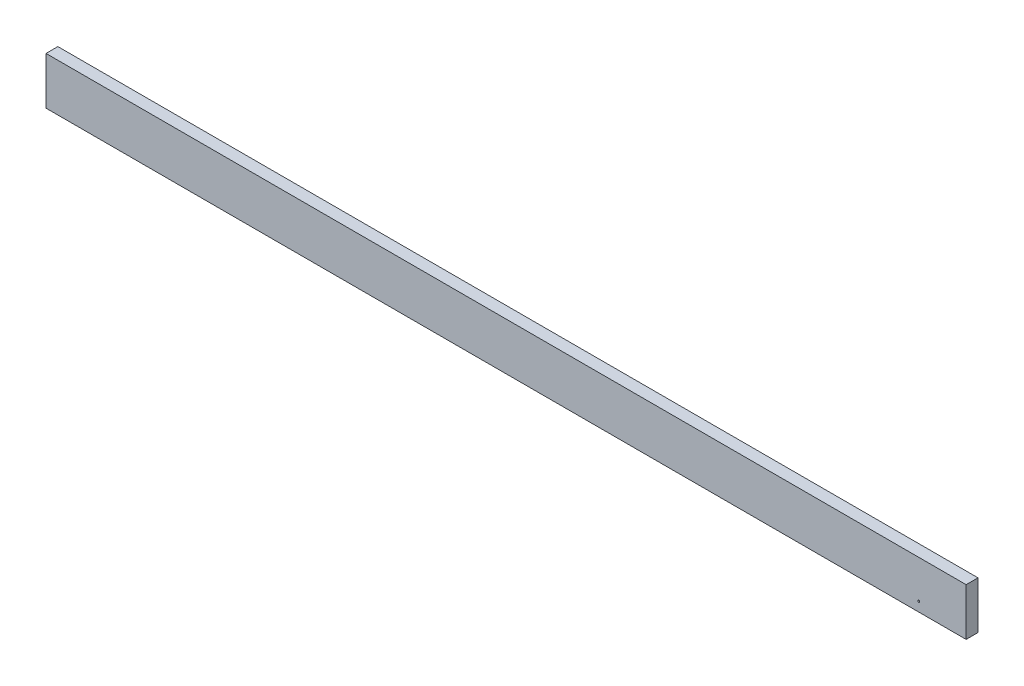
from build123d import *

# Parameters (mm, degrees)
SKETCH1_W                 = 194
SKETCH1_H                 = 10
BOSS_EXTRUDE1_DEPTH       = 2.5
SCALE1_SCALE              = 10
F_6_CLEARANCE_HOLE2_D     = 3.81
F_6_CLEARANCE_HOLE2_DEPTH = 49


with BuildPart() as part:
    # Sketch1 → Boss-Extrude1 (new body)
    with BuildSketch(Plane.XY):
        with Locations((97, 5)):
            Rectangle(SKETCH1_W, SKETCH1_H)
    extrude(amount=BOSS_EXTRUDE1_DEPTH)


with BuildPart() as part_1:
    # Scale1: scaled about (0, 0, 0)
    add(part.part.scale(SCALE1_SCALE))

    # #6 Clearance Hole2
    with Locations(Plane(origin=(2049.418477494, 550, 0), x_dir=(-1, 0, 0), z_dir=(0, 0, -1))):
        with Locations((209.418477494, -530.194488108)):
            Hole(F_6_CLEARANCE_HOLE2_D / 2, depth=F_6_CLEARANCE_HOLE2_DEPTH)


solid = part_1.part
